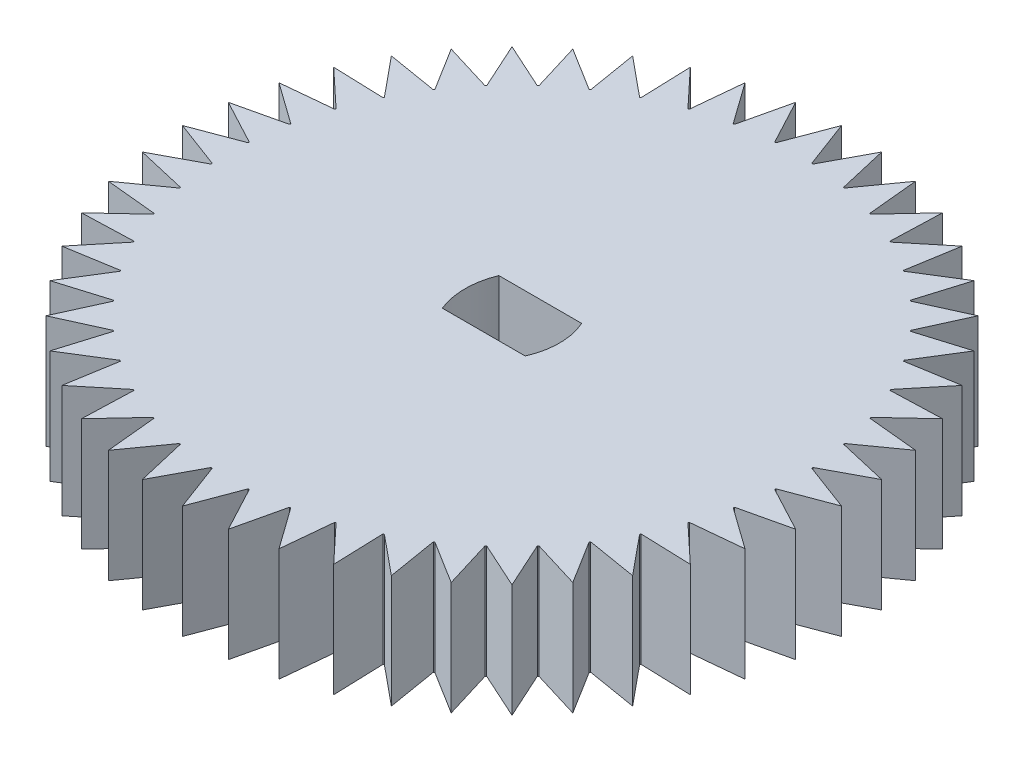
from build123d import *

# Parameters (mm, degrees)
EXTRUDE_5_DEPTH = 6


with BuildPart() as part:
    # Эскиз1 → Бобышка-Вытянуть5 (new body)
    with BuildSketch(Plane(origin=(0, 0, 0), x_dir=(1, 0, 0), z_dir=(0, 1, 0))):
        with BuildLine():
            Line((2.895366476, 14.71790926), (2.284208364, 17.350285074))
            Line((2.284208364, 17.350285074), (1.012565965, 14.965784649))
            ThreePointArc((1.012565965, 14.965784649), (0.981046938, 14.967883849), (0.949523561, 14.969916667))
            Line((0.949523561, 14.969916667), (0, 17.5))
            Line((0, 17.5), (-0.949523561, 14.969916667))
            ThreePointArc((-0.949523561, 14.969916667), (-0.981046938, 14.967883849), (-1.012565965, 14.965784649))
            Line((-1.012565965, 14.965784649), (-2.284208364, 17.350285074))
            Line((-2.284208364, 17.350285074), (-2.895366476, 14.71790926))
            ThreePointArc((-2.895366476, 14.71790926), (-2.92635483, 14.711779206), (-2.957330207, 14.705583907))
            Line((-2.957330207, 14.705583907), (-4.529333289, 16.90370196))
            Line((-4.529333289, 16.90370196), (-4.791668867, 14.214074344))
            ThreePointArc((-4.791668867, 14.214074344), (-4.82159198, 14.203951942), (-4.851493708, 14.193766547))
            Line((-4.851493708, 14.193766547), (-6.696960066, 16.167891819))
            Line((-6.696960066, 16.167891819), (-6.605984476, 13.467032676))
            ThreePointArc((-6.605984476, 13.467032676), (-6.634330353, 13.453091123), (-6.662646808, 13.439089906))
            Line((-6.662646808, 13.439089906), (-8.75, 15.155444566))
            Line((-8.75, 15.155444566), (-8.307269859, 12.489566345))
            ThreePointArc((-8.307269859, 12.489566345), (-8.333553495, 12.472044185), (-8.359800173, 12.454466711))
            Line((-8.359800173, 12.454466711), (-10.653325008, 13.883683455))
            Line((-10.653325008, 13.883683455), (-9.866415551, 11.298400071))
            ThreePointArc((-9.866415551, 11.298400071), (-9.890187227, 11.277597112), (-9.91391504, 11.256744138))
            Line((-9.91391504, 11.256744138), (-12.374368671, 12.374368671))
            Line((-12.374368671, 12.374368671), (-11.256744138, 9.91391504))
            ThreePointArc((-11.256744138, 9.91391504), (-11.277597112, 9.890187227), (-11.298400071, 9.866415551))
            Line((-11.298400071, 9.866415551), (-13.883683455, 10.653325008))
            Line((-13.883683455, 10.653325008), (-12.454466711, 8.359800173))
            ThreePointArc((-12.454466711, 8.359800173), (-12.472044185, 8.333553495), (-12.489566345, 8.307269859))
            Line((-12.489566345, 8.307269859), (-15.155444566, 8.75))
            Line((-15.155444566, 8.75), (-13.439089906, 6.662646808))
            ThreePointArc((-13.439089906, 6.662646808), (-13.453091123, 6.634330353), (-13.467032676, 6.605984476))
            Line((-13.467032676, 6.605984476), (-16.167891819, 6.696960066))
            Line((-16.167891819, 6.696960066), (-14.193766547, 4.851493708))
            ThreePointArc((-14.193766547, 4.851493708), (-14.203951942, 4.82159198), (-14.214074344, 4.791668867))
            Line((-14.214074344, 4.791668867), (-16.90370196, 4.529333289))
            Line((-16.90370196, 4.529333289), (-14.705583907, 2.957330207))
            ThreePointArc((-14.705583907, 2.957330207), (-14.711779206, 2.92635483), (-14.71790926, 2.895366476))
            Line((-14.71790926, 2.895366476), (-17.350285074, 2.284208364))
            Line((-17.350285074, 2.284208364), (-14.965784649, 1.012565965))
            ThreePointArc((-14.965784649, 1.012565965), (-14.967883849, 0.981046938), (-14.969916667, 0.949523561))
            Line((-14.969916667, 0.949523561), (-17.5, 0))
            Line((-17.5, 0), (-14.969916667, -0.949523561))
            ThreePointArc((-14.969916667, -0.949523561), (-14.967883849, -0.981046938), (-14.965784649, -1.012565965))
            Line((-14.965784649, -1.012565965), (-17.350285074, -2.284208364))
            Line((-17.350285074, -2.284208364), (-14.71790926, -2.895366476))
            ThreePointArc((-14.71790926, -2.895366476), (-14.711779206, -2.92635483), (-14.705583907, -2.957330207))
            Line((-14.705583907, -2.957330207), (-16.90370196, -4.529333289))
            Line((-16.90370196, -4.529333289), (-14.214074344, -4.791668867))
            ThreePointArc((-14.214074344, -4.791668867), (-14.203951942, -4.82159198), (-14.193766547, -4.851493708))
            Line((-14.193766547, -4.851493708), (-16.167891819, -6.696960066))
            Line((-16.167891819, -6.696960066), (-13.467032676, -6.605984476))
            ThreePointArc((-13.467032676, -6.605984476), (-13.453091123, -6.634330353), (-13.439089906, -6.662646808))
            Line((-13.439089906, -6.662646808), (-15.155444566, -8.75))
            Line((-15.155444566, -8.75), (-12.489566345, -8.307269859))
            ThreePointArc((-12.489566345, -8.307269859), (-12.472044185, -8.333553495), (-12.454466711, -8.359800173))
            Line((-12.454466711, -8.359800173), (-13.883683455, -10.653325008))
            Line((-13.883683455, -10.653325008), (-11.298400071, -9.866415551))
            ThreePointArc((-11.298400071, -9.866415551), (-11.277597112, -9.890187227), (-11.256744138, -9.91391504))
            Line((-11.256744138, -9.91391504), (-12.374368671, -12.374368671))
            Line((-12.374368671, -12.374368671), (-9.91391504, -11.256744138))
            ThreePointArc((-9.91391504, -11.256744138), (-9.890187227, -11.277597112), (-9.866415551, -11.298400071))
            Line((-9.866415551, -11.298400071), (-10.653325008, -13.883683455))
            Line((-10.653325008, -13.883683455), (-8.359800173, -12.454466711))
            ThreePointArc((-8.359800173, -12.454466711), (-8.333553495, -12.472044185), (-8.307269859, -12.489566345))
            Line((-8.307269859, -12.489566345), (-8.75, -15.155444566))
            Line((-8.75, -15.155444566), (-6.662646808, -13.439089906))
            ThreePointArc((-6.662646808, -13.439089906), (-6.634330353, -13.453091123), (-6.605984476, -13.467032676))
            Line((-6.605984476, -13.467032676), (-6.696960066, -16.167891819))
            Line((-6.696960066, -16.167891819), (-4.851493708, -14.193766547))
            ThreePointArc((-4.851493708, -14.193766547), (-4.82159198, -14.203951942), (-4.791668867, -14.214074344))
            Line((-4.791668867, -14.214074344), (-4.529333289, -16.90370196))
            Line((-4.529333289, -16.90370196), (-2.957330207, -14.705583907))
            ThreePointArc((-2.957330207, -14.705583907), (-2.92635483, -14.711779206), (-2.895366476, -14.71790926))
            Line((-2.895366476, -14.71790926), (-2.284208364, -17.350285074))
            Line((-2.284208364, -17.350285074), (-1.012565965, -14.965784649))
            ThreePointArc((-1.012565965, -14.965784649), (-0.981046938, -14.967883849), (-0.949523561, -14.969916667))
            Line((-0.949523561, -14.969916667), (0, -17.5))
            Line((0, -17.5), (0.949523561, -14.969916667))
            ThreePointArc((0.949523561, -14.969916667), (0.981046938, -14.967883849), (1.012565965, -14.965784649))
            Line((1.012565965, -14.965784649), (2.284208364, -17.350285074))
            Line((2.284208364, -17.350285074), (2.895366476, -14.71790926))
            ThreePointArc((2.895366476, -14.71790926), (2.92635483, -14.711779206), (2.957330207, -14.705583907))
            Line((2.957330207, -14.705583907), (4.529333289, -16.90370196))
            Line((4.529333289, -16.90370196), (4.791668867, -14.214074344))
            ThreePointArc((4.791668867, -14.214074344), (4.82159198, -14.203951942), (4.851493708, -14.193766547))
            Line((4.851493708, -14.193766547), (6.696960066, -16.167891819))
            Line((6.696960066, -16.167891819), (6.605984476, -13.467032676))
            ThreePointArc((6.605984476, -13.467032676), (6.634330353, -13.453091123), (6.662646808, -13.439089906))
            Line((6.662646808, -13.439089906), (8.75, -15.155444566))
            Line((8.75, -15.155444566), (8.307269859, -12.489566345))
            ThreePointArc((8.307269859, -12.489566345), (8.333553495, -12.472044185), (8.359800173, -12.454466711))
            Line((8.359800173, -12.454466711), (10.653325008, -13.883683455))
            Line((10.653325008, -13.883683455), (9.866415551, -11.298400071))
            ThreePointArc((9.866415551, -11.298400071), (9.890187227, -11.277597112), (9.91391504, -11.256744138))
            Line((9.91391504, -11.256744138), (12.374368671, -12.374368671))
            Line((12.374368671, -12.374368671), (11.256744138, -9.91391504))
            ThreePointArc((11.256744138, -9.91391504), (11.277597112, -9.890187227), (11.298400071, -9.866415551))
            Line((11.298400071, -9.866415551), (13.883683455, -10.653325008))
            Line((13.883683455, -10.653325008), (12.454466711, -8.359800173))
            ThreePointArc((12.454466711, -8.359800173), (12.472044185, -8.333553495), (12.489566345, -8.307269859))
            Line((12.489566345, -8.307269859), (15.155444566, -8.75))
            Line((15.155444566, -8.75), (13.439089906, -6.662646808))
            ThreePointArc((13.439089906, -6.662646808), (13.453091123, -6.634330353), (13.467032676, -6.605984476))
            Line((13.467032676, -6.605984476), (16.167891819, -6.696960066))
            Line((16.167891819, -6.696960066), (14.193766547, -4.851493708))
            ThreePointArc((14.193766547, -4.851493708), (14.203951942, -4.82159198), (14.214074344, -4.791668867))
            Line((14.214074344, -4.791668867), (16.90370196, -4.529333289))
            Line((16.90370196, -4.529333289), (14.705583907, -2.957330207))
            ThreePointArc((14.705583907, -2.957330207), (14.711779206, -2.92635483), (14.71790926, -2.895366476))
            Line((14.71790926, -2.895366476), (17.350285074, -2.284208364))
            Line((17.350285074, -2.284208364), (14.965784649, -1.012565965))
            ThreePointArc((14.965784649, -1.012565965), (14.967883849, -0.981046938), (14.969916667, -0.949523561))
            Line((14.969916667, -0.949523561), (17.5, 0))
            Line((17.5, 0), (14.969916667, 0.949523561))
            ThreePointArc((14.969916667, 0.949523561), (14.967883849, 0.981046938), (14.965784649, 1.012565965))
            Line((14.965784649, 1.012565965), (17.350285074, 2.284208364))
            Line((17.350285074, 2.284208364), (14.71790926, 2.895366476))
            ThreePointArc((14.71790926, 2.895366476), (14.711779206, 2.92635483), (14.705583907, 2.957330207))
            Line((14.705583907, 2.957330207), (16.90370196, 4.529333289))
            Line((16.90370196, 4.529333289), (14.214074344, 4.791668867))
            ThreePointArc((14.214074344, 4.791668867), (14.203951942, 4.82159198), (14.193766547, 4.851493708))
            Line((14.193766547, 4.851493708), (16.167891819, 6.696960066))
            Line((16.167891819, 6.696960066), (13.467032676, 6.605984476))
            ThreePointArc((13.467032676, 6.605984476), (13.453091123, 6.634330353), (13.439089906, 6.662646808))
            Line((13.439089906, 6.662646808), (15.155444566, 8.75))
            Line((15.155444566, 8.75), (12.489566345, 8.307269859))
            ThreePointArc((12.489566345, 8.307269859), (12.472044185, 8.333553495), (12.454466711, 8.359800173))
            Line((12.454466711, 8.359800173), (13.883683455, 10.653325008))
            Line((13.883683455, 10.653325008), (11.298400071, 9.866415551))
            ThreePointArc((11.298400071, 9.866415551), (11.277597112, 9.890187227), (11.256744138, 9.91391504))
            Line((11.256744138, 9.91391504), (12.374368671, 12.374368671))
            Line((12.374368671, 12.374368671), (9.91391504, 11.256744138))
            ThreePointArc((9.91391504, 11.256744138), (9.890187227, 11.277597112), (9.866415551, 11.298400071))
            Line((9.866415551, 11.298400071), (10.653325008, 13.883683455))
            Line((10.653325008, 13.883683455), (8.359800173, 12.454466711))
            ThreePointArc((8.359800173, 12.454466711), (8.333553495, 12.472044185), (8.307269859, 12.489566345))
            Line((8.307269859, 12.489566345), (8.75, 15.155444566))
            Line((8.75, 15.155444566), (6.662646808, 13.439089906))
            ThreePointArc((6.662646808, 13.439089906), (6.634330353, 13.453091123), (6.605984476, 13.467032676))
            Line((6.605984476, 13.467032676), (6.696960066, 16.167891819))
            Line((6.696960066, 16.167891819), (4.851493708, 14.193766547))
            ThreePointArc((4.851493708, 14.193766547), (4.82159198, 14.203951942), (4.791668867, 14.214074344))
            Line((4.791668867, 14.214074344), (4.529333289, 16.90370196))
            Line((4.529333289, 16.90370196), (2.957330207, 14.705583907))
            ThreePointArc((2.957330207, 14.705583907), (2.92635483, 14.711779206), (2.895366476, 14.71790926))
        make_face()
        with BuildLine():
            ThreePointArc((2.2, 1.5), (2.517970617, 0), (2.2, -1.5))
            Line((2.2, -1.5), (-2.2, -1.5))
            ThreePointArc((-2.2, -1.5), (-2.493941045, 0), (-2.2, 1.5))
            Line((-2.2, 1.5), (2.2, 1.5))
        make_face(mode=Mode.SUBTRACT)
    extrude(amount=EXTRUDE_5_DEPTH)


solid = part.part
